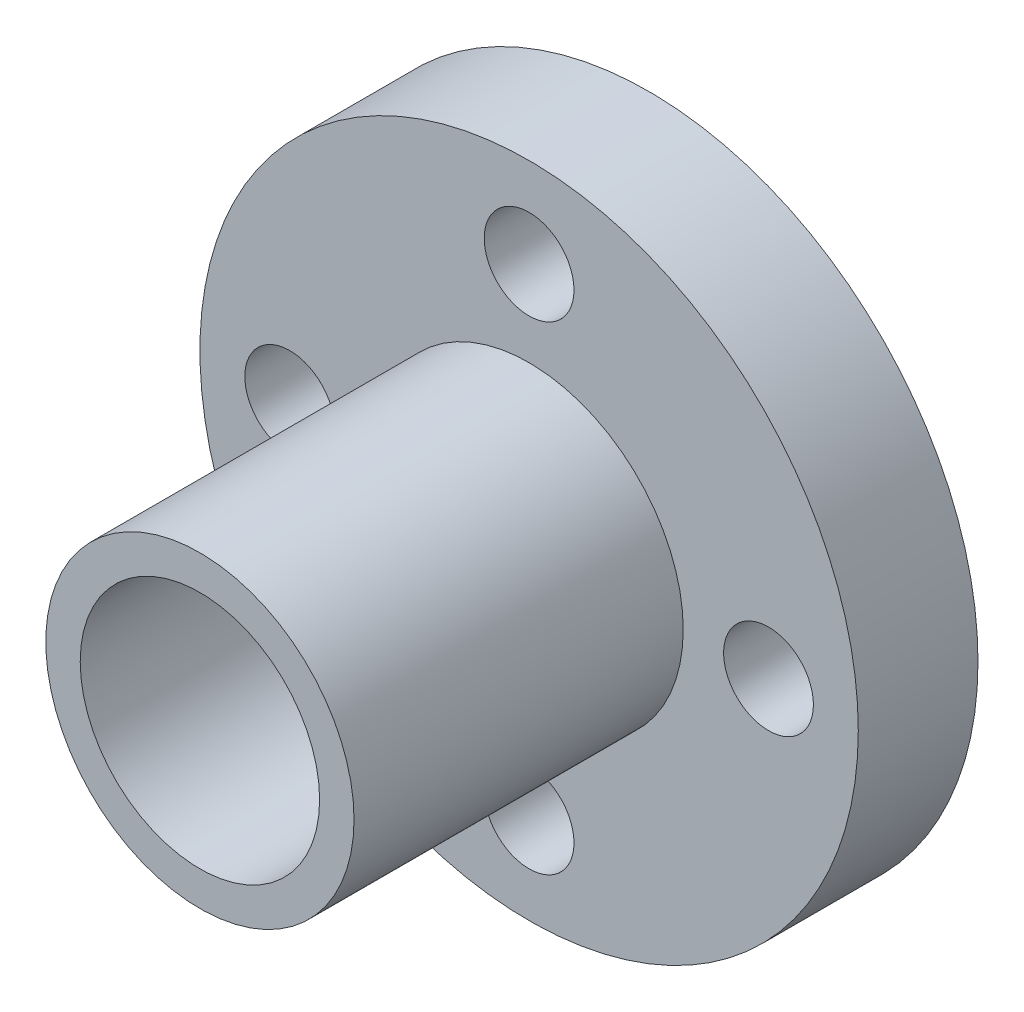
from build123d import *

# Parameters (mm, degrees)
SKETCH1_R           = 11
BOSS_EXTRUDE1_DEPTH = 4
SKETCH2_R           = 5.15
BOSS_EXTRUDE2_DEPTH = 11
SKETCH3_R           = 4
CUT_EXTRUDE1_DEPTH  = 22.610182785
SKETCH4_R           = 1.5
CUT_EXTRUDE2_DEPTH  = 20.052558883


with BuildPart() as part:
    # Sketch1 → Boss-Extrude1 (new body)
    with BuildSketch(Plane.XY):
        Circle(SKETCH1_R)
    extrude(amount=BOSS_EXTRUDE1_DEPTH)

    # Sketch2 → Boss-Extrude2 (add)
    with BuildSketch(Plane.XY.offset(4)):
        Circle(SKETCH2_R)
    extrude(amount=BOSS_EXTRUDE2_DEPTH)

    # Sketch3 → Cut-Extrude1 (cut, through all)
    with BuildSketch(Plane.XY.offset(15)):
        Circle(SKETCH3_R)
    extrude(amount=-CUT_EXTRUDE1_DEPTH, mode=Mode.SUBTRACT)

    # Sketch4 → Cut-Extrude2 (cut, through all)
    with BuildSketch(Plane.XY.offset(4)):
        with Locations((0, 8)):
            Circle(SKETCH4_R)
        with Locations((8, 0)):
            Circle(SKETCH4_R)
        with Locations((0, -8)):
            Circle(SKETCH4_R)
        with Locations((-8, 0)):
            Circle(SKETCH4_R)
    extrude(amount=-CUT_EXTRUDE2_DEPTH, mode=Mode.SUBTRACT)


solid = part.part
